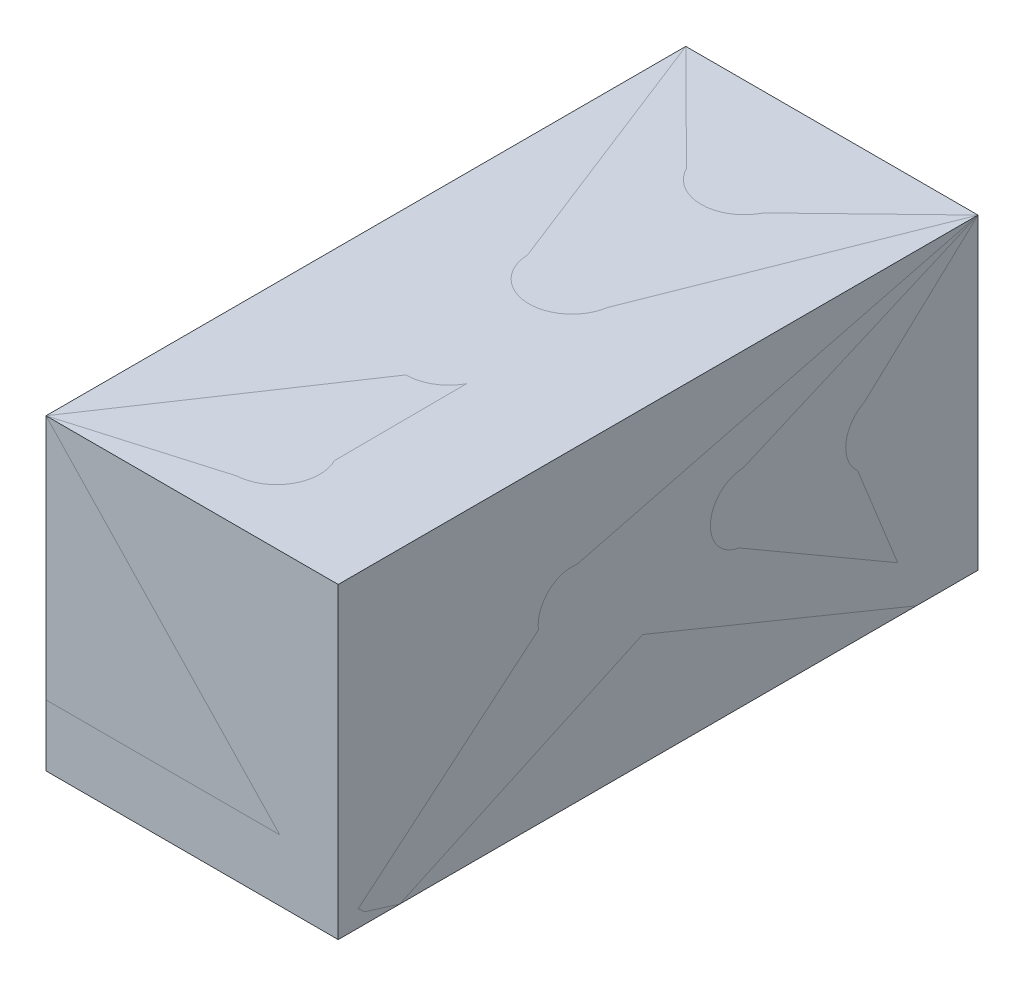
from build123d import *

# Parameters (mm, degrees)
ESQUISSE1_W                                        = 23.75
ESQUISSE1_H                                        = 25
BOSS_EXTRU_1_DEPTH                                 = 52
ENL_V_MAT_EXTRU_1_DEPTH                            = 6
CHAMBRAGE_POUR_VIS_T_TE_RONDE_BOMB_E_M_D           = 3.4
CHAMBRAGE_POUR_VIS_T_TE_RONDE_BOMB_E_M_CBORE_D     = 7
CHAMBRAGE_POUR_VIS_T_TE_RONDE_BOMB_E_M_CBORE_DEPTH = 2.4
D_GAGEMENT_M51_D                                   = 5.5
CONG_2_R                                           = 5


with BuildPart() as part:
    # Esquisse1 → Boss.-Extru.1 (new body)
    with BuildSketch(Plane.XY):
        with Locations((-11.875, 181.1)):
            Rectangle(ESQUISSE1_W, ESQUISSE1_H)
    extrude(amount=-BOSS_EXTRU_1_DEPTH)

    # Esquisse2 → Enlèv. mat.-Extru.1 (cut)
    with BuildSketch(Plane.XZ.offset(-168.6)):
        with BuildLine():
            Line((-12.304054054, -13.506165792), (-18.5, -13.506165792))
            ThreePointArc((-18.5, -13.506165792), (-19.207106781, -13.799059011), (-19.5, -14.506165792))
            Line((-19.5, -14.506165792), (-19.5, -21))
            ThreePointArc((-19.5, -21), (-19.13645949, -23.30671757), (-18.081081081, -25.389812398))
            ThreePointArc((-18.081081081, -25.389812398), (-16.607571798, -28.298209557), (-16.1, -31.518826659))
            Line((-16.1, -31.518826659), (-16.1, -45))
            ThreePointArc((-16.1, -45), (-14.899137803, -47.899137803), (-12, -49.1))
            ThreePointArc((-12, -49.1), (-9.100862197, -47.899137803), (-7.9, -45))
            Line((-7.9, -45), (-7.9, -31.518826659))
            ThreePointArc((-7.9, -31.518826659), (-7.392428202, -28.298209557), (-5.918918919, -25.389812398))
            ThreePointArc((-5.918918919, -25.389812398), (-4.5, -21), (-5.918918919, -16.610187602))
            ThreePointArc((-5.918918919, -16.610187602), (-8.450179508, -14.393278084), (-11.695945946, -13.506165792))
            ThreePointArc((-11.695945946, -13.506165792), (-12, -13.5), (-12.304054054, -13.506165792))
        make_face()
    extrude(amount=-ENL_V_MAT_EXTRU_1_DEPTH, mode=Mode.SUBTRACT)

    # Chambrage pour vis à tête ronde bombée M31 (through all)
    with Locations(Plane(origin=(0, 193.6, 0), x_dir=(1, 0, 0), z_dir=(0, 1, 0))):
        with Locations((-12, 21), (-12, 45)):
            CounterBoreHole(CHAMBRAGE_POUR_VIS_T_TE_RONDE_BOMB_E_M_D / 2, CHAMBRAGE_POUR_VIS_T_TE_RONDE_BOMB_E_M_CBORE_D / 2, CHAMBRAGE_POUR_VIS_T_TE_RONDE_BOMB_E_M_CBORE_DEPTH)

    # Dégagement M51 (through all)
    with Locations(Plane(origin=(0, 182.6, -8), x_dir=(0, 0, 1), z_dir=(1, 0, 0))):
        with Locations((0, 0), (-25, 0)):
            Hole(D_GAGEMENT_M51_D / 2)

    # Congé2
    cong_2_edges = [part.edges().sort_by_distance(p)[0] for p in [
        (-11.875, 168.6, 0),
    ]]
    fillet(cong_2_edges, radius=CONG_2_R)


with BuildPart() as body_2:
    # Symétrie1: mirrored copy
    add(part.part.mirror(Plane.XY.offset(-26)))


solid = Compound([part.part, body_2.part])
